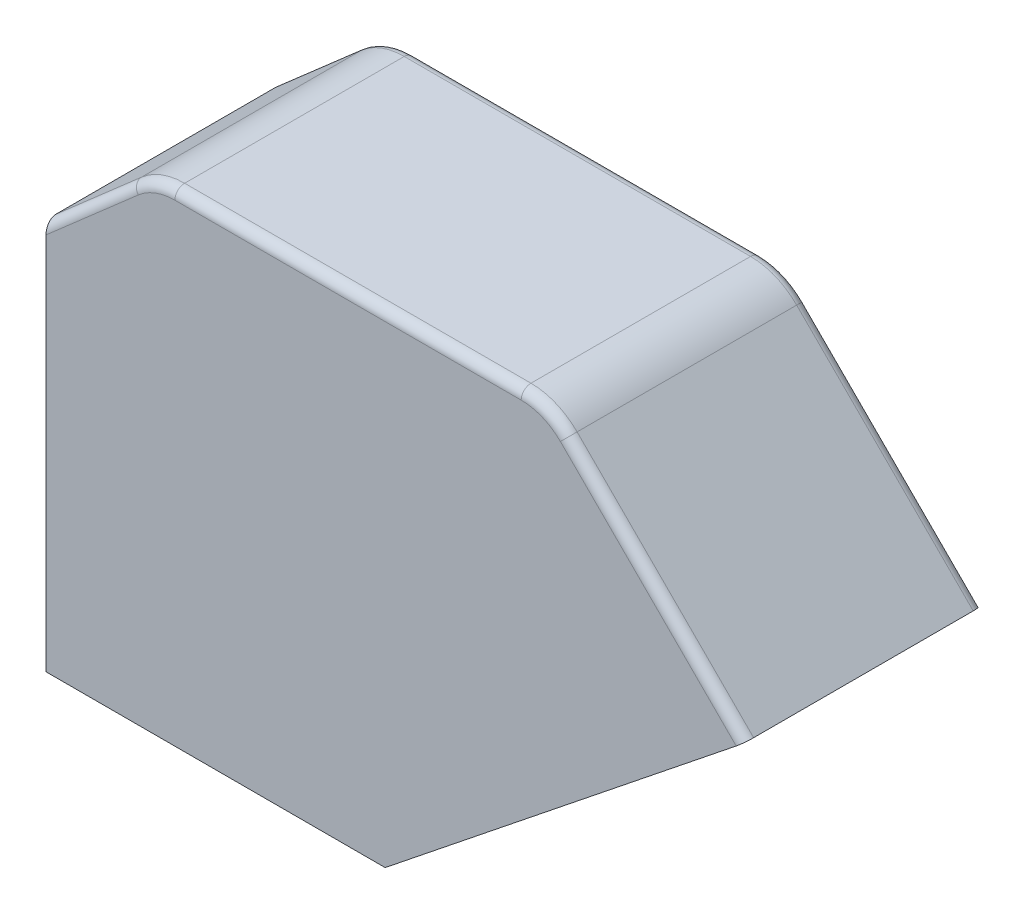
from build123d import *

# Parameters (mm, degrees)
BOSS_EXTRUDE1_DEPTH      = 10
BOSS_EXTRUDE1_DEPTH_BACK = 540
FILLET1_R                = 150
FILLET2_R                = 22.5
SHELL1_T                 = -4.5
CUT_EXTRUDE1_START       = -535
CUT_EXTRUDE1_DEPTH       = 79
SKETCH2_W                = 151.608609382
SKETCH2_H                = 22.921634695
BOSS_EXTRUDE2_DEPTH      = 50


with BuildPart() as part:
    # Sketch1 → Boss-Extrude1 (new, two sides: drawn at the far end of the back side and taken through both)
    with BuildSketch(Plane.XY.offset(-BOSS_EXTRUDE1_DEPTH_BACK)):
        Polygon((0, 0), (-780, 0), (-780, 900), (-540, 1110), (375, 1110), (825, 660), align=None)
    extrude(amount=BOSS_EXTRUDE1_DEPTH + BOSS_EXTRUDE1_DEPTH_BACK)

    # Fillet1
    fillet1_edges = [part.edges().sort_by_distance(p)[0] for p in [
        (-540, 1110, -265),
        (375, 1110, -265),
    ]]
    fillet(fillet1_edges, radius=FILLET1_R)

    # Fillet2
    fillet2_edges = [part.edges().sort_by_distance(p)[0] for p in [
        (621.966991411, 863.033008589, -540),
        (-85.38588347, 1110, -540),
        (-85.38588347, 1110, 10),
        (-681.207711882, 986.443252103, -540),
        (-536.398733566, 1100.415411602, -540),
        (370.270480499, 1098.581929877, -540),
        (-681.207711882, 986.443252103, 10),
        (-536.398733566, 1100.415411602, 10),
        (370.270480499, 1098.581929877, 10),
        (621.966991411, 863.033008589, 10),
    ]]
    fillet(fillet2_edges, radius=FILLET2_R)

    # Shell1
    shell1_openings = [part.faces().sort_by_distance(p)[0] for p in [
        (-390, 0, -265),
        (-780, 449.741271018, -265),
        (412.346232546, 329.876986037, -265),
    ]]
    offset(amount=SHELL1_T, openings=shell1_openings)

    # Sketch1<2> → Cut-Extrude1 (cut)
    with BuildSketch(Plane.XY.offset(CUT_EXTRUDE1_START)):
        Polygon((0, 0), (-780, 0), (-780, 900), (-540, 1110), (375, 1110), (825, 660), align=None)
    extrude(amount=-CUT_EXTRUDE1_DEPTH, mode=Mode.SUBTRACT)

    # Sketch2 → Boss-Extrude2 (add)
    with BuildSketch(Plane(origin=(0, 0, 5.5), x_dir=(-1, 0, 0), z_dir=(0, 0, -1))):
        with Locations((390, 11.460817348)):
            Rectangle(SKETCH2_W, SKETCH2_H)
    extrude(amount=BOSS_EXTRUDE2_DEPTH)


solid = part.part
